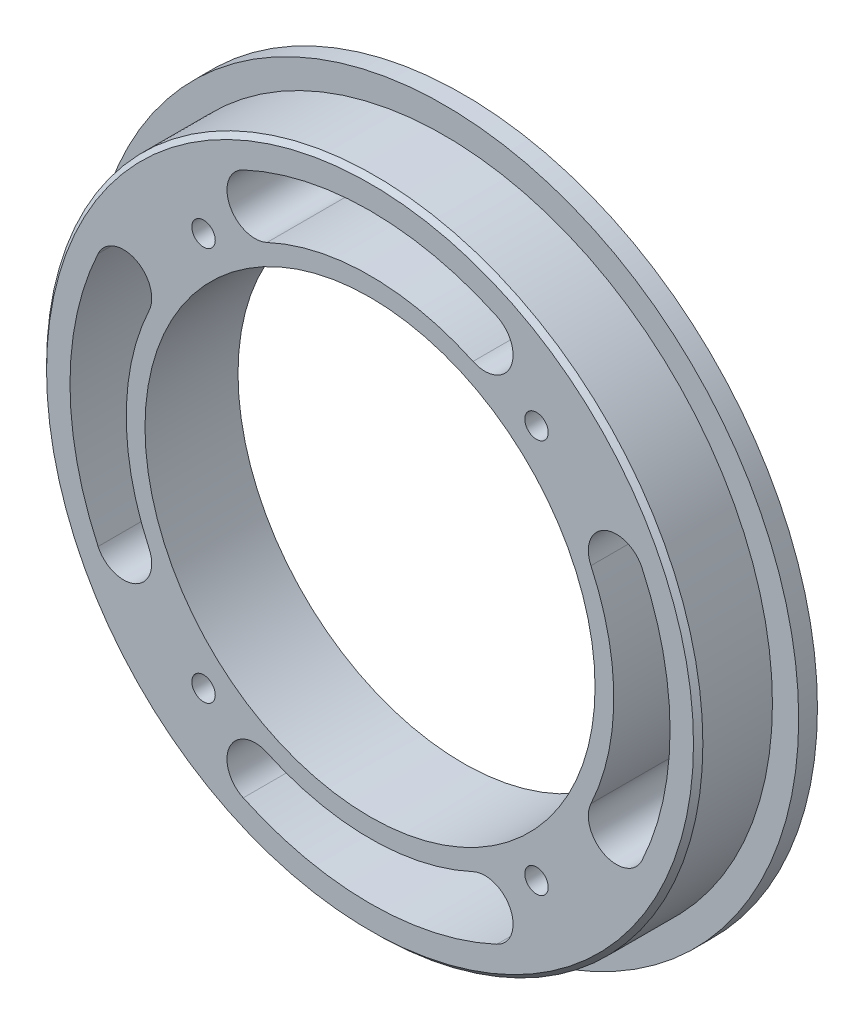
from build123d import *
from build123d.topology import SkipClean

# Parameters (mm, degrees)
SKETCH_1_R          = 35
SKETCH_1_R_2        = 24
EXTRUDE_1_DEPTH     = 7.92
EXTRUDE_START       = 2
SKETCH_2_R          = 37.8
SKETCH_2_R_2        = 24
EXTRUDE_2_DEPTH     = 2
HOLE_WIZARD_M3_1_D  = 2.5
CHAMFER_1_SIZE      = 0.5
CUT_EXTRUDE_1_DEPTH = 9.92


with BuildPart() as part:
    # 草图1 → 凸台-拉伸1 (new body)
    with BuildSketch(Plane.XY):
        Circle(SKETCH_1_R)
        Circle(SKETCH_1_R_2, mode=Mode.SUBTRACT)
    extrude(amount=EXTRUDE_1_DEPTH)

    # 草图2 → 凸台-拉伸2 (add)
    with SkipClean():  # the faces are left unmerged after this step: merging them gives an invalid solid
        with BuildSketch(Plane(origin=(0, 0, 0), x_dir=(-1, 0, 0), z_dir=(0, 0, -1)).offset(EXTRUDE_START)):
            Circle(SKETCH_2_R)
            Circle(SKETCH_2_R_2, mode=Mode.SUBTRACT)
        extrude(amount=-EXTRUDE_2_DEPTH)

    # M3 螺纹孔1 (through all)
    with Locations(Plane.XY.offset(7.92)):
        with Locations((-17.755280905, 21), (-17.755280905, -21), (17.755280905, -21), (17.755280905, 21)):
            Hole(HOLE_WIZARD_M3_1_D / 2)

    # 倒角1
    chamfer_1_edges = [part.edges().sort_by_distance(p)[0] for p in [
        (-35, 0, 7.92),
    ]]
    chamfer(chamfer_1_edges, length=CHAMFER_1_SIZE)

    # 草图9 → 切除-拉伸1 (cut)
    with SkipClean():  # the faces are left unmerged after this step: merging them gives an invalid solid
        with BuildSketch(Plane.XY.offset(7.92)):
            with BuildLine():
                ThreePointArc((29.001849185, -13.523784376), (32, 0), (29.001849185, 13.523784376))
                ThreePointArc((29.001849185, 13.523784376), (25.015071039, 14.974852952), (23.564002463, 10.988074805))
                ThreePointArc((23.564002463, 10.988074805), (26, 0), (23.564002463, -10.988074805))
                ThreePointArc((23.564002463, -10.988074805), (25.015071039, -14.974852952), (29.001849185, -13.523784376))
            make_face()
            with BuildLine():
                ThreePointArc((-13.523784376, -29.001849185), (0, -32), (13.523784376, -29.001849185))
                ThreePointArc((13.523784376, -29.001849185), (14.974852952, -25.015071039), (10.988074805, -23.564002463))
                ThreePointArc((10.988074805, -23.564002463), (0, -26), (-10.988074805, -23.564002463))
                ThreePointArc((-10.988074805, -23.564002463), (-14.974852952, -25.015071039), (-13.523784376, -29.001849185))
            make_face()
            with BuildLine():
                ThreePointArc((-29.001849185, 13.523784376), (-32, 0), (-29.001849185, -13.523784376))
                ThreePointArc((-29.001849185, -13.523784376), (-25.015071039, -14.974852952), (-23.564002463, -10.988074805))
                ThreePointArc((-23.564002463, -10.988074805), (-26, 0), (-23.564002463, 10.988074805))
                ThreePointArc((-23.564002463, 10.988074805), (-25.015071039, 14.974852952), (-29.001849185, 13.523784376))
            make_face()
            with BuildLine():
                ThreePointArc((13.523784376, 29.001849185), (0, 32), (-13.523784376, 29.001849185))
                ThreePointArc((-13.523784376, 29.001849185), (-14.974852952, 25.015071039), (-10.988074805, 23.564002463))
                ThreePointArc((-10.988074805, 23.564002463), (0, 26), (10.988074805, 23.564002463))
                ThreePointArc((10.988074805, 23.564002463), (14.974852952, 25.015071039), (13.523784376, 29.001849185))
            make_face()
        extrude(amount=-CUT_EXTRUDE_1_DEPTH, mode=Mode.SUBTRACT)


solid = part.part
